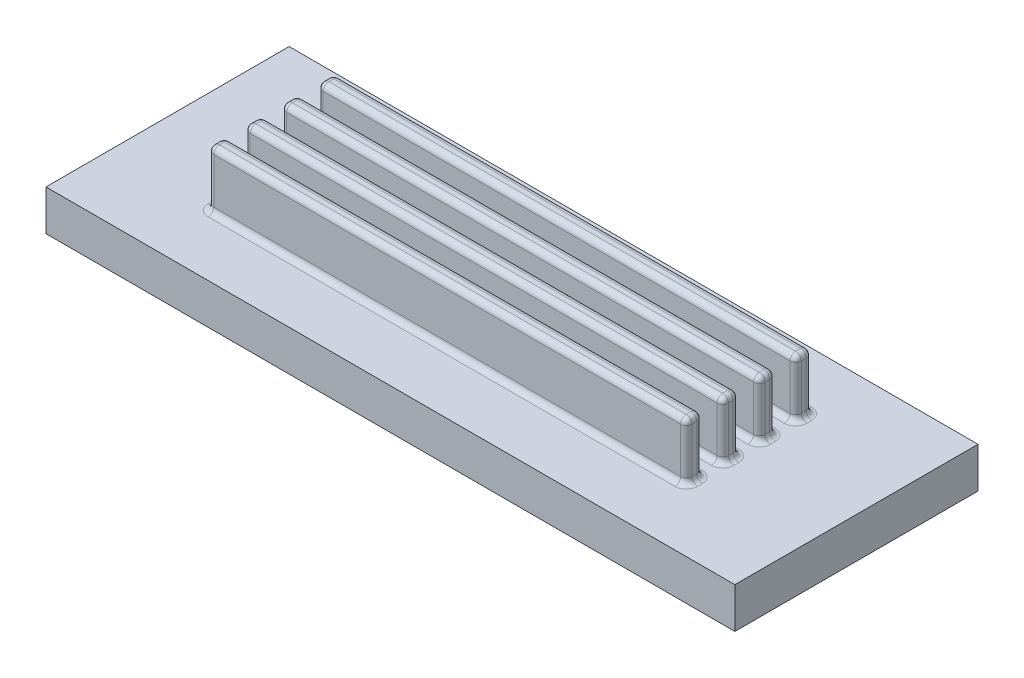
from build123d import *

# Parameters (mm, degrees)
SKETCH1_W           = 85
SKETCH1_H           = 30
BOSS_EXTRUDE1_DEPTH = 5
SKETCH2_W           = 59
SKETCH2_H           = 2
BOSS_EXTRUDE2_DEPTH = 7
FILLET1_R           = 0.7


with BuildPart() as part:
    # Sketch1 → Boss-Extrude1 (new body)
    with BuildSketch(Plane(origin=(0, 0, 0), x_dir=(1, 0, 0), z_dir=(0, 1, 0))):
        with Locations((42.5, 15)):
            Rectangle(SKETCH1_W, SKETCH1_H)
    extrude(amount=BOSS_EXTRUDE1_DEPTH)

    # Sketch2 → Boss-Extrude2 (add)
    with BuildSketch(Plane(origin=(0, 5, 0), x_dir=(1, 0, 0), z_dir=(0, 1, 0))):
        with Locations((42, 22)):
            Rectangle(SKETCH2_W, SKETCH2_H)
        with Locations((42, 17.5)):
            Rectangle(SKETCH2_W, SKETCH2_H)
        with Locations((42, 13)):
            Rectangle(SKETCH2_W, SKETCH2_H)
        with Locations((42, 8.5)):
            Rectangle(SKETCH2_W, SKETCH2_H)
    extrude(amount=BOSS_EXTRUDE2_DEPTH)

    # Fillet1
    fillet1_edges = [part.edges().sort_by_distance(p)[0] for p in [
        (12.5, 5, -22),
        (12.5, 8.5, -23),
        (42, 5, -21),
        (12.5, 8.5, -21),
        (71.5, 5, -22),
        (71.5, 8.5, -21),
        (42, 5, -23),
        (71.5, 8.5, -23),
        (12.5, 12, -22),
        (42, 12, -21),
        (71.5, 12, -22),
        (42, 12, -23),
        (12.5, 5, -17.5),
        (12.5, 8.5, -18.5),
        (42, 5, -16.5),
        (12.5, 8.5, -16.5),
        (71.5, 5, -17.5),
        (71.5, 8.5, -16.5),
        (42, 5, -18.5),
        (71.5, 8.5, -18.5),
        (12.5, 12, -17.5),
        (42, 12, -16.5),
        (71.5, 12, -17.5),
        (42, 12, -18.5),
        (12.5, 5, -13),
        (12.5, 8.5, -14),
        (42, 5, -12),
        (12.5, 8.5, -12),
        (71.5, 5, -13),
        (71.5, 8.5, -12),
        (42, 5, -14),
        (71.5, 8.5, -14),
        (12.5, 12, -13),
        (42, 12, -12),
        (71.5, 12, -13),
        (42, 12, -14),
        (12.5, 5, -8.5),
        (12.5, 8.5, -9.5),
        (42, 5, -7.5),
        (12.5, 8.5, -7.5),
        (71.5, 5, -8.5),
        (71.5, 8.5, -7.5),
        (42, 5, -9.5),
        (71.5, 8.5, -9.5),
        (12.5, 12, -8.5),
        (42, 12, -7.5),
        (71.5, 12, -8.5),
        (42, 12, -9.5),
    ]]
    fillet(fillet1_edges, radius=FILLET1_R)


solid = part.part
